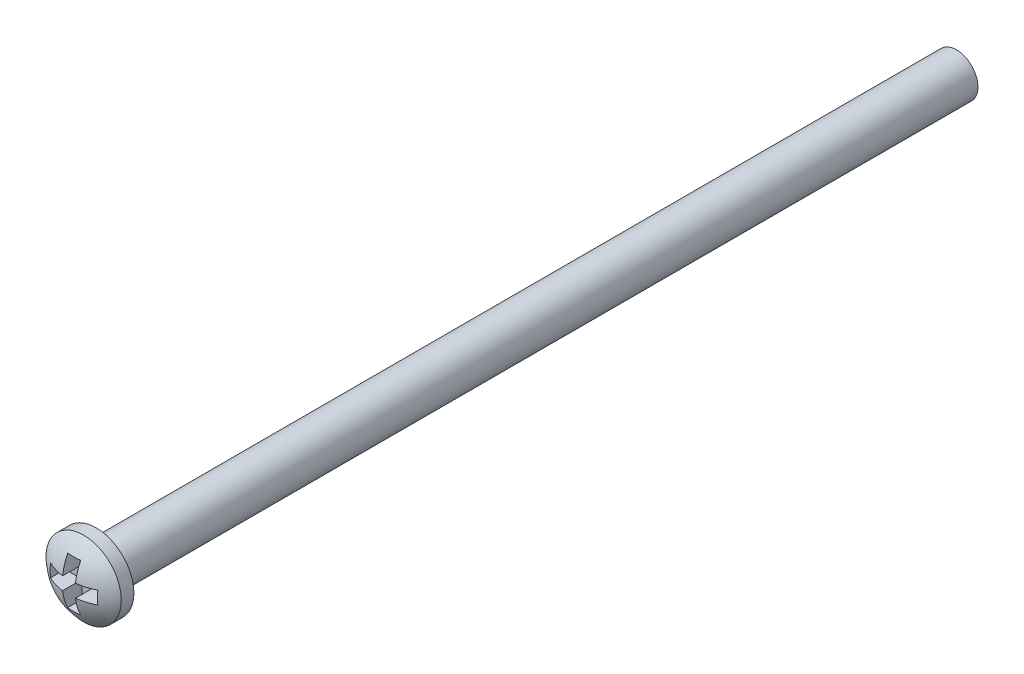
from build123d import *

# Parameters (mm, degrees)
SKETCH_1_R        = 1
EXTRUDE_198_DEPTH = 40
PH1_START         = 1.31
PH1_DEPTH         = 0.96


with BuildPart() as part:
    # 草图1 → Extrude 198 (new body)
    with BuildSketch(Plane.XY):
        Circle(SKETCH_1_R)
    extrude(amount=-EXTRUDE_198_DEPTH)

    # 草图6 → Revolve 324 (revolve)
    with BuildSketch(Plane(origin=(0, 0, 0), x_dir=(1, 0, 0), z_dir=(0, 1, 0)), mode=Mode.PRIVATE) as revolve_324_sk:
        with BuildLine():
            Line((0, 0), (1.75, 0))
            Line((1.75, 0), (1.75, -0.585357107))
            ThreePointArc((1.75, -0.585357107), (0.945147404, -1.114453798), (0, -1.3))
            Line((0, -1.3), (0, 0))
        make_face()
    revolve(revolve_324_sk.sketch.rotate(Axis((0, 0, -2), (0, 0, 1)), 180), axis=Axis((0, 0, -2), (0, 0, 1)))

    # 草图7 → 十字槽_PH1_简化 (cut)
    with BuildSketch(Plane.XY.offset(PH1_START)):
        Polygon((-0.3, -1.1), (0.3, -1.1), (0.3, -0.3), (1.1, -0.3), (1.1, 0.3), (0.3, 0.3), (0.3, 1.1), (-0.3, 1.1), (-0.3, 0.3), (-1.1, 0.3), (-1.1, -0.3), (-0.3, -0.3), align=None)
    extrude(amount=-PH1_DEPTH, mode=Mode.SUBTRACT)


solid = part.part
